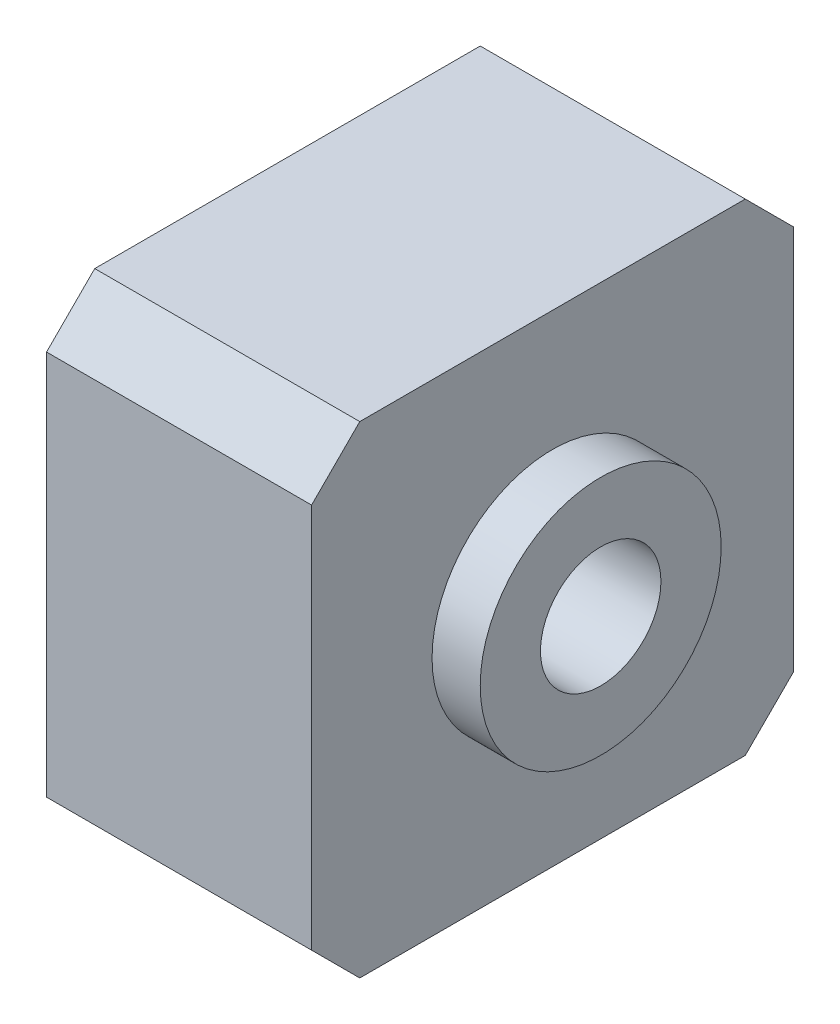
from build123d import *

# Parameters (mm, degrees)
SKETCH1_W           = 20
SKETCH1_H           = 20
BOSS_EXTRUDE1_DEPTH = 17
SKETCH2_R           = 15.353568197
SKETCH2_R_2         = 5
CUT_EXTRUDE1_DEPTH  = 2
CUT_EXTRUDE2_START  = -4
SKETCH3_R           = 15.635411304
SKETCH3_R_2         = 5
CUT_EXTRUDE2_DEPTH  = 4
SKETCH4_R           = 2.5
CUT_EXTRUDE3_DEPTH  = 23.113344387
CHAMFER1_SIZE       = 2
SKETCH5_R           = 2.75
CUT_EXTRUDE4_DEPTH  = 2


with BuildPart() as part:
    # Sketch1 → Boss-Extrude1 (new body)
    with BuildSketch(Plane(origin=(0, 0, 0), x_dir=(0, 0, -1), z_dir=(1, 0, 0))):
        Rectangle(SKETCH1_W, SKETCH1_H)
    extrude(amount=-BOSS_EXTRUDE1_DEPTH)

    # Sketch2 → Cut-Extrude1 (cut)
    with BuildSketch(Plane(origin=(0, 0, 0), x_dir=(0, 0, -1), z_dir=(1, 0, 0))):
        Circle(SKETCH2_R)
        Circle(SKETCH2_R_2, mode=Mode.SUBTRACT)
    extrude(amount=-CUT_EXTRUDE1_DEPTH, mode=Mode.SUBTRACT)

    # Sketch3 → Cut-Extrude2 (cut)
    with BuildSketch(Plane.ZY.offset(17).offset(CUT_EXTRUDE2_START)):
        Circle(SKETCH3_R)
        with Locations(Location((0, 0, 0), (0, 0, 180))):
            Circle(SKETCH3_R_2, mode=Mode.SUBTRACT)
    extrude(amount=CUT_EXTRUDE2_DEPTH, mode=Mode.SUBTRACT)

    # Sketch4 → Cut-Extrude3 (cut, through all)
    with BuildSketch(Plane(origin=(0, 0, 0), x_dir=(0, 0, -1), z_dir=(1, 0, 0))):
        Circle(SKETCH4_R)
    extrude(amount=-CUT_EXTRUDE3_DEPTH, mode=Mode.SUBTRACT)

    # Chamfer1
    chamfer1_edges = [part.edges().sort_by_distance(p)[0] for p in [
        (-7.5, -10, -10),
        (-7.5, -10, 10),
        (-7.5, 10, -10),
        (-7.5, 10, 10),
    ]]
    chamfer(chamfer1_edges, length=CHAMFER1_SIZE)

    # Sketch5 → Cut-Extrude4 (cut)
    with BuildSketch(Plane(origin=(0, 0, -10), x_dir=(-1, 0, 0), z_dir=(0, 0, -1))):
        with Locations(Location((7, 0, 0), (0, 0, 90))):
            Circle(SKETCH5_R)
    extrude(amount=-CUT_EXTRUDE4_DEPTH, mode=Mode.SUBTRACT)


solid = part.part
